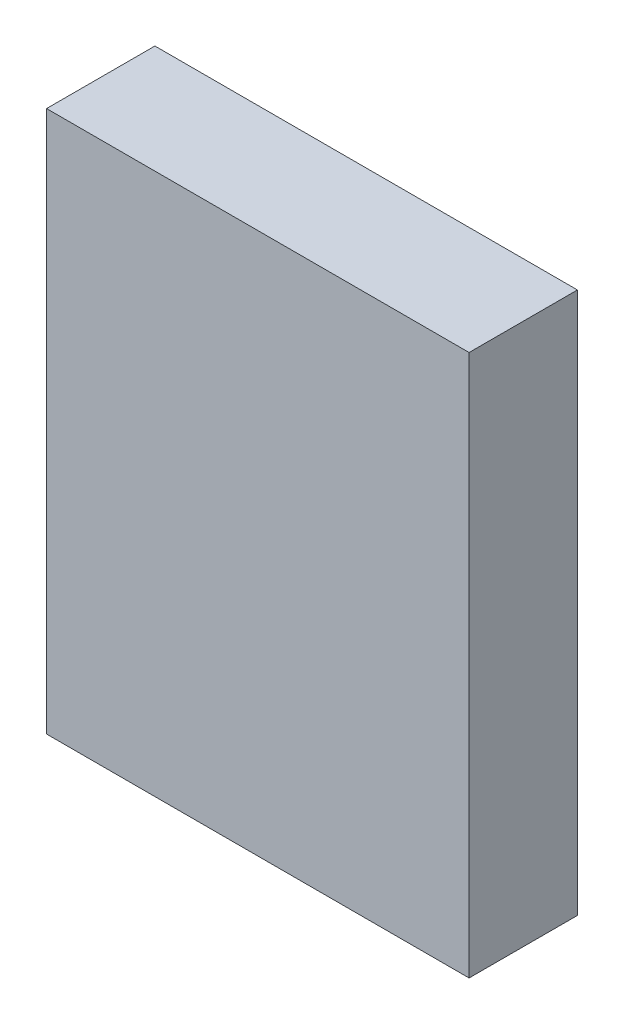
from build123d import *

# Parameters (mm, degrees)
SKETCH1_W           = 3.9
SKETCH1_H           = 5
BOSS_EXTRUDE1_DEPTH = 1


with BuildPart() as part:
    # Sketch1 → Boss-Extrude1 (new body)
    with BuildSketch(Plane.XY):
        Rectangle(SKETCH1_W, SKETCH1_H)
    extrude(amount=BOSS_EXTRUDE1_DEPTH)


solid = part.part
